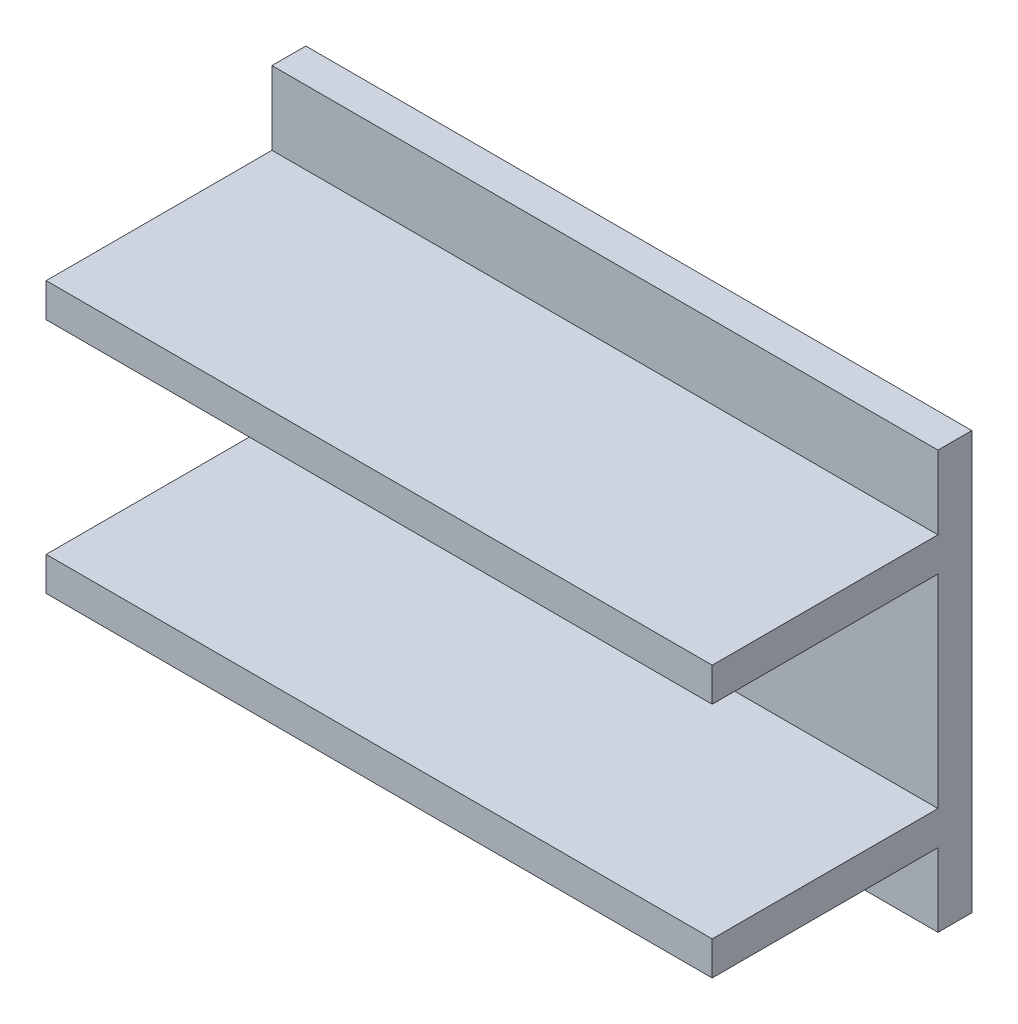
from build123d import *

# Parameters (mm, degrees)
SKETCH_1_W      = 59
SKETCH_1_H      = 37
EXTRUDE_1_DEPTH = 3
SKETCH_2_W      = 59
SKETCH_2_H      = 3
EXTRUDE_2_DEPTH = 20


with BuildPart() as part:
    # 草图1 → 凸台-拉伸1 (new body)
    with BuildSketch(Plane.XY):
        Rectangle(SKETCH_1_W, SKETCH_1_H)
    extrude(amount=EXTRUDE_1_DEPTH)

    # 草图2 → 凸台-拉伸2 (add)
    with BuildSketch(Plane.XY.offset(3)):
        with Locations((0, -10.5)):
            Rectangle(SKETCH_2_W, SKETCH_2_H)
        with Locations((0, 10.5)):
            Rectangle(SKETCH_2_W, SKETCH_2_H)
    extrude(amount=EXTRUDE_2_DEPTH)


solid = part.part
